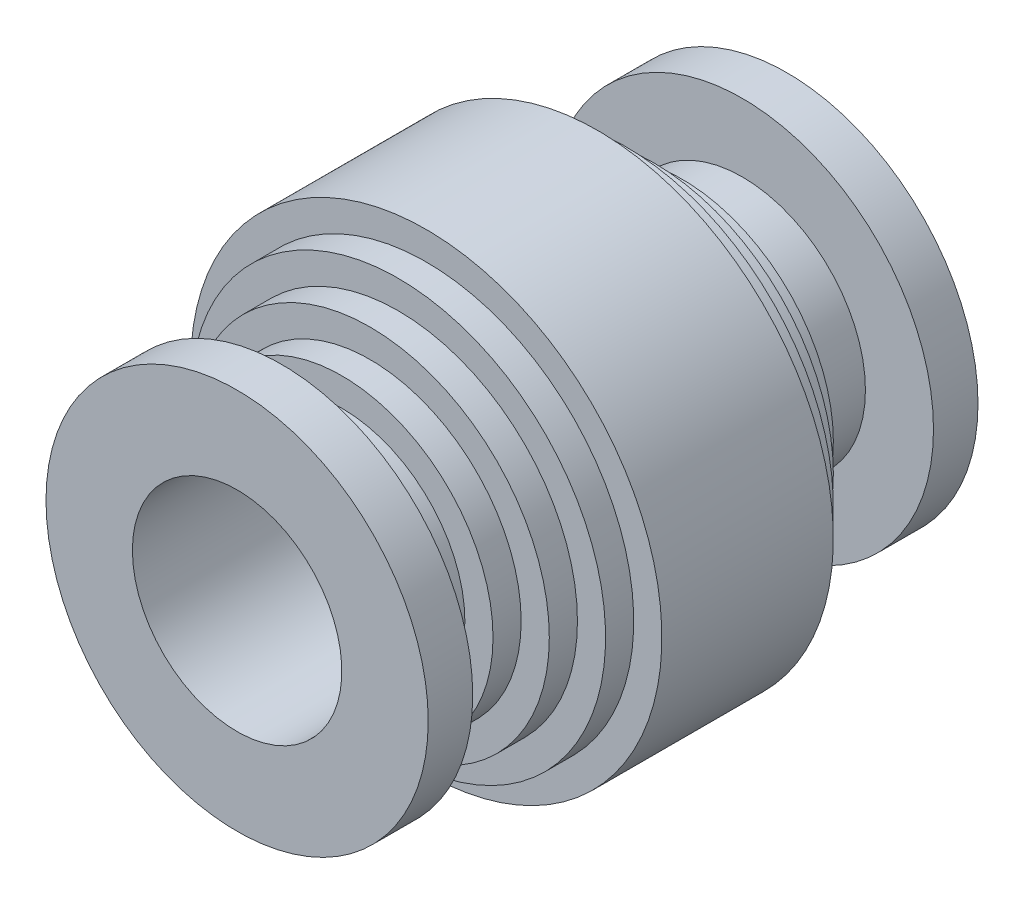
from build123d import *


with BuildPart() as part:
    # Sketch1 → Revolve1 (revolve)
    with BuildSketch(Plane(origin=(0, 0, 0), x_dir=(1, 0, 0), z_dir=(0, 1, 0)), mode=Mode.PRIVATE) as revolve1_sk:
        Polygon((4, 0), (7.3, 0), (7.3, 1.7), (4.7, 1.7), (4.7, 4), (5.775, 4), (5.775, 5.075), (6.85, 5.075), (6.85, 6.15), (7.925, 6.15), (7.925, 7.225), (9, 7.225), (9, 8.3), (9, 12.7), (9, 13.775), (7.925, 13.775), (7.925, 14.85), (6.85, 14.85), (6.85, 15.925), (5.775, 15.925), (5.775, 17), (4.7, 17), (4.7, 19.3), (7.3, 19.3), (7.3, 21), (4, 21), align=None)
    revolve(revolve1_sk.sketch.rotate(Axis((0, 0, -15), (0, 0, 1)), 180), axis=Axis((0, 0, -15), (0, 0, 1)))


solid = part.part
